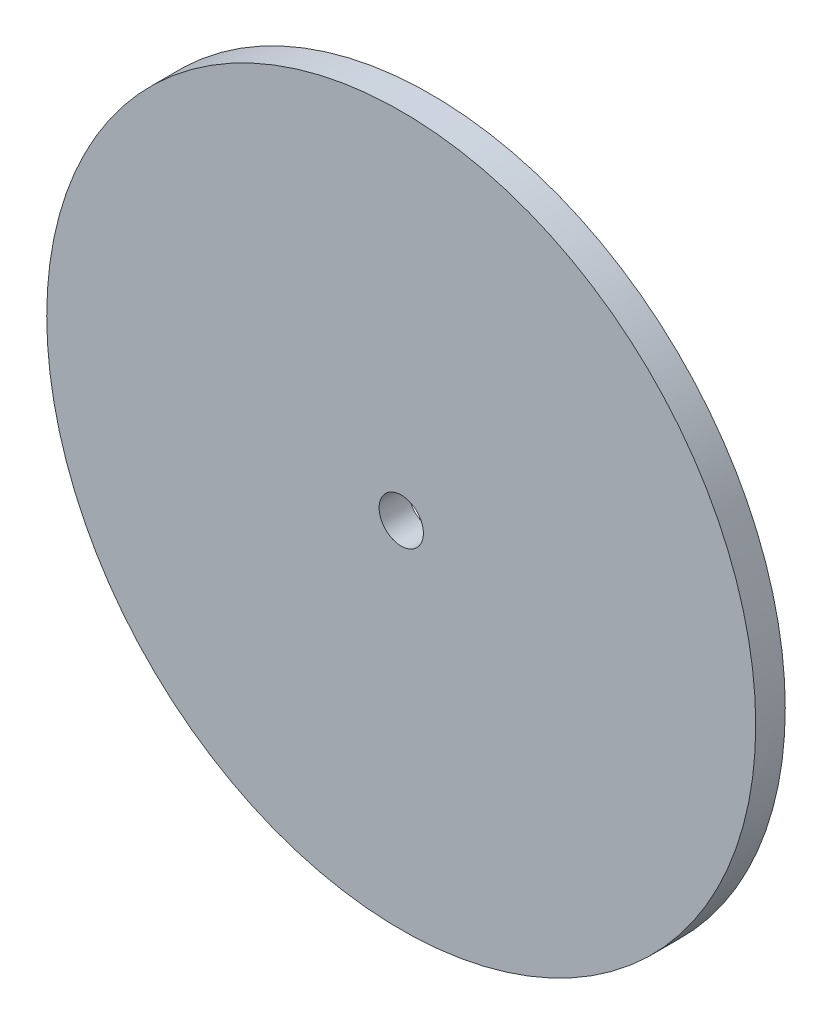
from build123d import *

# Parameters (mm, degrees)
SKETCH1_R               = 76.2
BOSS_EXTRUDE1_DEPTH     = 6.35
CUT_EXTRUDE3_DEPTH      = 108.95
CUT_EXTRUDE3_DEPTH_BACK = 108.95
SKETCH1_4_R             = 4.7625
SKETCH2_R               = 3.175
CUT_EXTRUDE4_DEPTH      = 3.175


with BuildPart() as part:
    # Sketch1 → Boss-Extrude1 (new body)
    with BuildSketch(Plane.XY):
        Circle(SKETCH1_R)
    extrude(amount=BOSS_EXTRUDE1_DEPTH)

    # Sketch1<4> → Cut-Extrude3 (cut, two sides: drawn at the far end of the back side and taken through both)
    with BuildSketch(Plane.XY.offset(-CUT_EXTRUDE3_DEPTH_BACK)):
        Circle(SKETCH1_4_R)
    extrude(amount=CUT_EXTRUDE3_DEPTH + CUT_EXTRUDE3_DEPTH_BACK, mode=Mode.SUBTRACT)

    # Sketch2 → Cut-Extrude4 (cut)
    with BuildSketch(Plane(origin=(0, 0, 0), x_dir=(-1, 0, 0), z_dir=(0, 0, -1))):
        with Locations((0, 63.5)):
            Circle(SKETCH2_R)
        with Locations((0, -63.5)):
            Circle(SKETCH2_R)
    extrude(amount=-CUT_EXTRUDE4_DEPTH, mode=Mode.SUBTRACT)


solid = part.part
